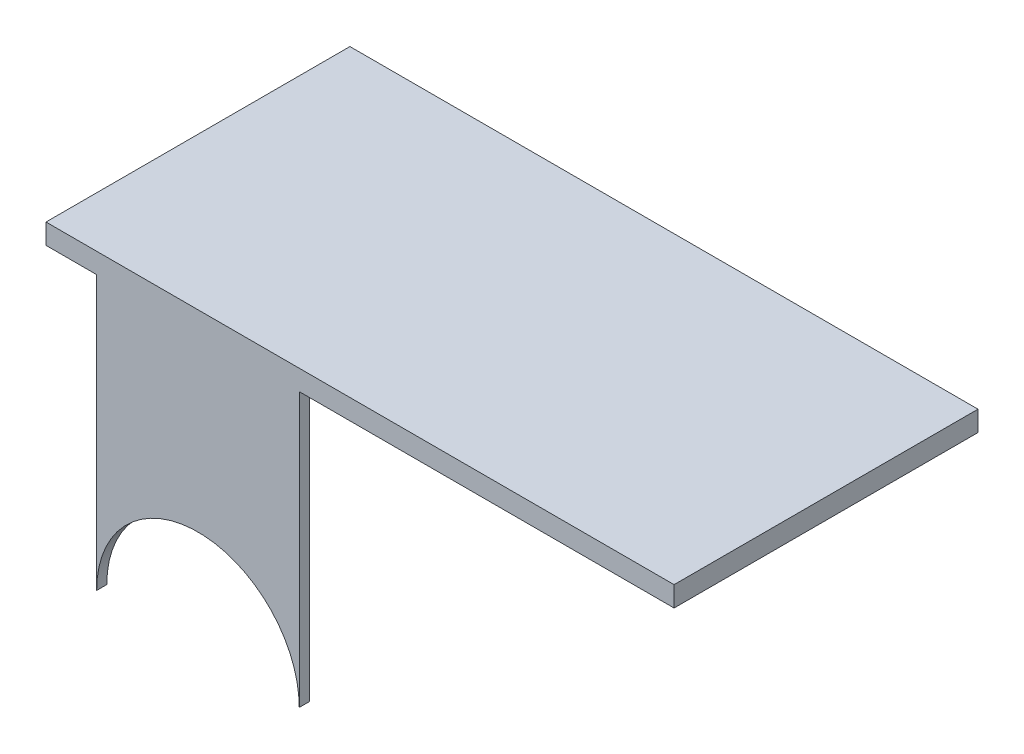
from build123d import *

# Parameters (mm, degrees)
BOSS_EXTRUDE1_DEPTH = 1
BOSS_EXTRUDE2_DEPTH = 2


with BuildPart() as part:
    # Sketch2 → Boss-Extrude1 (new body)
    with BuildSketch(Plane.XY):
        with BuildLine():
            Line((-44.924968499, -5.131156509), (-44.924968499, 21.868843491))
            Line((-44.924968499, 21.868843491), (-24.924968499, 21.868843491))
            Line((-24.924968499, 21.868843491), (-24.924968499, -5.131156509))
            ThreePointArc((-24.924968499, -5.131156509), (-34.924968499, 4.868843491), (-44.924968499, -5.131156509))
        make_face()
    extrude(amount=BOSS_EXTRUDE1_DEPTH)

    # Sketch3 → Boss-Extrude2 (add)
    with BuildSketch(Plane(origin=(0, 21.868843491, 0), x_dir=(1, 0, 0), z_dir=(0, 1, 0))):
        Polygon((-44.924968499, -1), (-49.924968499, -1), (-49.924968499, 29), (12.075031501, 29), (12.075031501, -1), align=None)
    extrude(amount=BOSS_EXTRUDE2_DEPTH)


solid = part.part
